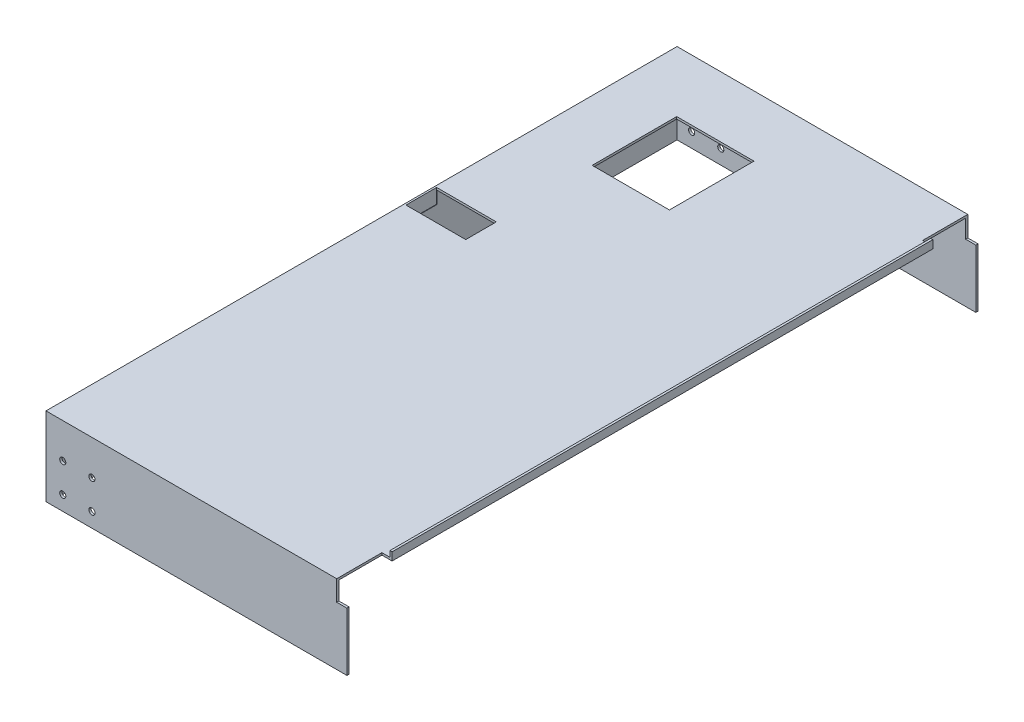
from build123d import *

# Parameters (mm, degrees)
BOSS_EXTRUDE4_DEPTH  = 1.5
SKETCH5_W            = 205
SKETCH5_H            = 54
BOSS_EXTRUDE5_DEPTH  = 1.5
SKETCH8_W            = 1.5
SKETCH8_H            = 430
BOSS_EXTRUDE14_DEPTH = 4
SKETCH7_W            = 205
SKETCH7_H            = 54
BOSS_EXTRUDE18_DEPTH = 1.5
SKETCH9_W            = 433
SKETCH9_H            = 54
BOSS_EXTRUDE19_DEPTH = 1.5
SKETCH10_R           = 2.1
CUT_EXTRUDE1_DEPTH   = 10
CUT_EXTRUDE2_START   = -10
SKETCH17_R           = 2.1
CUT_EXTRUDE2_DEPTH   = 10
SKETCH16_R           = 2.1
CUT_EXTRUDE3_DEPTH   = 10
CUT_EXTRUDE4_START   = -10
SKETCH11_R           = 2.1
CUT_EXTRUDE4_DEPTH   = 10
SKETCH12_R           = 2.1
CUT_EXTRUDE5_DEPTH   = 10
SKETCH13_R           = 2.1
CUT_EXTRUDE6_DEPTH   = 10
CUT_EXTRUDE7_START   = -10
SKETCH14_R           = 2.1
CUT_EXTRUDE7_DEPTH   = 10
CUT_EXTRUDE8_START   = -10
SKETCH15_R           = 2.1
CUT_EXTRUDE8_DEPTH   = 10
SKETCH18_W           = 41
SKETCH18_H           = 21.003646253
CUT_EXTRUDE9_DEPTH   = 10
SKETCH21_W           = 53
SKETCH21_H           = 58
CUT_EXTRUDE12_DEPTH  = 10
SKETCH23_W           = 7
SKETCH23_H           = 18
CUT_EXTRUDE14_DEPTH  = 31
SKETCH24_W           = 7
SKETCH24_H           = 18
CUT_EXTRUDE15_DEPTH  = 31


with BuildPart() as part:
    # Sketch4 → Boss-Extrude4 (new body)
    with BuildSketch(Plane(origin=(0, 0, 0), x_dir=(1, 0, 0), z_dir=(0, 1, 0))):
        Polygon((124.01347733, 430), (329.01347733, 430), (329.01347733, 0), (124.01347733, 0), (124.01347733, 200), (124.01347733, 365), align=None)
    extrude(amount=BOSS_EXTRUDE4_DEPTH)

    # Sketch5 → Boss-Extrude5 (add)
    with BuildSketch(Plane.XY):
        with Locations((226.51347733, -25.5)):
            Rectangle(SKETCH5_W, SKETCH5_H)
    extrude(amount=BOSS_EXTRUDE5_DEPTH)

    # Sketch8 → Boss-Extrude14 (add)
    with BuildSketch(Plane(origin=(0, 1.5, 0), x_dir=(1, 0, 0), z_dir=(0, 1, 0))):
        with Locations((328.26347733, 215)):
            Rectangle(SKETCH8_W, SKETCH8_H)
    extrude(amount=BOSS_EXTRUDE14_DEPTH)

    # Sketch7 → Boss-Extrude18 (add)
    with BuildSketch(Plane(origin=(0, 0, -430), x_dir=(-1, 0, 0), z_dir=(0, 0, -1))):
        with Locations((-226.51347733, -25.5)):
            Rectangle(SKETCH7_W, SKETCH7_H)
    extrude(amount=BOSS_EXTRUDE18_DEPTH)

    # Sketch9 → Boss-Extrude19 (add)
    with BuildSketch(Plane.ZY.offset(-124.01347733)):
        with Locations((-215, -25.5)):
            Rectangle(SKETCH9_W, SKETCH9_H)
    extrude(amount=BOSS_EXTRUDE19_DEPTH)

    # Sketch10 → Cut-Extrude1 (cut)
    with BuildSketch(Plane(origin=(0, 0, -431.5), x_dir=(-1, 0, 0), z_dir=(0, 0, -1))):
        with Locations((-154.01347733, -42.5)):
            Circle(SKETCH10_R)
    extrude(amount=-CUT_EXTRUDE1_DEPTH, mode=Mode.SUBTRACT)

    # Sketch17 → Cut-Extrude2 (cut)
    with BuildSketch(Plane.XY.offset(1.5).offset(CUT_EXTRUDE2_START)):
        with Locations(Location((154.01347733, -42.5, 0), (0, 0, 180))):
            Circle(SKETCH17_R)
    extrude(amount=CUT_EXTRUDE2_DEPTH, mode=Mode.SUBTRACT)

    # Sketch16 → Cut-Extrude3 (cut)
    with BuildSketch(Plane.XY.offset(1.5)):
        with Locations((134.023652304, -42.521836229)):
            Circle(SKETCH16_R)
    extrude(amount=-CUT_EXTRUDE3_DEPTH, mode=Mode.SUBTRACT)

    # Sketch11 → Cut-Extrude4 (cut)
    with BuildSketch(Plane(origin=(0, 0, -431.5), x_dir=(-1, 0, 0), z_dir=(0, 0, -1)).offset(CUT_EXTRUDE4_START)):
        with Locations(Location((-134.023652304, -42.521836229, 0), (0, 0, 180))):
            Circle(SKETCH11_R)
    extrude(amount=CUT_EXTRUDE4_DEPTH, mode=Mode.SUBTRACT)

    # Sketch12 → Cut-Extrude5 (cut)
    with BuildSketch(Plane(origin=(0, 0, -431.5), x_dir=(-1, 0, 0), z_dir=(0, 0, -1))):
        with Locations((-134.017306734, -22.477341223)):
            Circle(SKETCH12_R)
    extrude(amount=-CUT_EXTRUDE5_DEPTH, mode=Mode.SUBTRACT)

    # Sketch13 → Cut-Extrude6 (cut)
    with BuildSketch(Plane(origin=(0, 0, -431.5), x_dir=(-1, 0, 0), z_dir=(0, 0, -1))):
        with Locations((-154.003183789, -22.514424589)):
            Circle(SKETCH13_R)
    extrude(amount=-CUT_EXTRUDE6_DEPTH, mode=Mode.SUBTRACT)

    # Sketch14 → Cut-Extrude7 (cut)
    with BuildSketch(Plane.XY.offset(1.5).offset(CUT_EXTRUDE7_START)):
        with Locations(Location((134.017306734, -22.477341223, 0), (0, 0, 180))):
            Circle(SKETCH14_R)
    extrude(amount=CUT_EXTRUDE7_DEPTH, mode=Mode.SUBTRACT)

    # Sketch15 → Cut-Extrude8 (cut)
    with BuildSketch(Plane.XY.offset(1.5).offset(CUT_EXTRUDE8_START)):
        with Locations(Location((154.003183789, -22.514424589, 0), (0, 0, 180))):
            Circle(SKETCH15_R)
    extrude(amount=CUT_EXTRUDE8_DEPTH, mode=Mode.SUBTRACT)

    # Sketch18 → Cut-Extrude9 (cut)
    with BuildSketch(Plane(origin=(0, 1.5, 0), x_dir=(1, 0, 0), z_dir=(0, 1, 0))):
        with Locations((144.235269619, 254.779446877)):
            Rectangle(SKETCH18_W, SKETCH18_H)
    extrude(amount=-CUT_EXTRUDE9_DEPTH, mode=Mode.SUBTRACT)

    # Sketch21 → Cut-Extrude12 (cut)
    with BuildSketch(Plane(origin=(0, 1.5, 0), x_dir=(1, 0, 0), z_dir=(0, 1, 0))):
        with Locations((190.51347733, 360.765424222)):
            Rectangle(SKETCH21_W, SKETCH21_H)
    extrude(amount=-CUT_EXTRUDE12_DEPTH, mode=Mode.SUBTRACT)

    # Sketch23 → Cut-Extrude14 (cut)
    with BuildSketch(Plane.XY.offset(1.5)):
        with Locations((325.51347733, -3.5)):
            Rectangle(SKETCH23_W, SKETCH23_H)
    extrude(amount=-CUT_EXTRUDE14_DEPTH, mode=Mode.SUBTRACT)

    # Sketch24 → Cut-Extrude15 (cut)
    with BuildSketch(Plane(origin=(0, 0, -431.5), x_dir=(-1, 0, 0), z_dir=(0, 0, -1))):
        with Locations((-325.51347733, -3.5)):
            Rectangle(SKETCH24_W, SKETCH24_H)
    extrude(amount=-CUT_EXTRUDE15_DEPTH, mode=Mode.SUBTRACT)


solid = part.part
